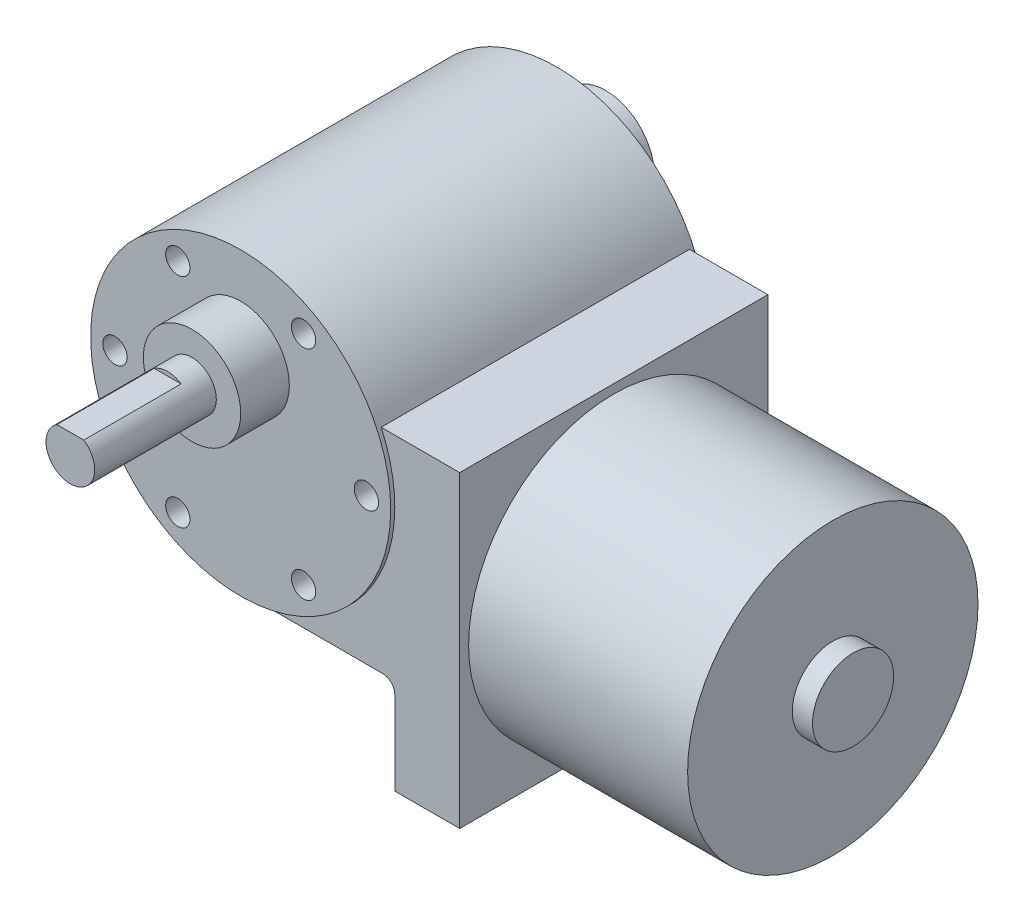
from build123d import *

# Parameters (mm, degrees)
SKETCH_1_R           = 6
EXTRUDE_1_DEPTH      = 6
SKETCH_2_R           = 3
EXTRUDE_2_DEPTH      = 15
SKETCH_4_OUTSIDE_W   = 19.4
SKETCH_4_OUTSIDE_H   = 19.4
CUT_EXTRUDE_1_DEPTH  = 12
SKETCH_5_R           = 18.5
EXTRUDE_3_DEPTH      = 39
EXTRUDE_START        = 6
SKETCH_6_R           = 6
EXTRUDE_4_DEPTH      = 6
SKETCH_7_W           = 38
SKETCH_7_H           = 38
EXTRUDE_5_DEPTH      = 8
EXTRUDE_6_REACH      = 71.176
EXTRUDE_6_END_RADIUS = 18.5
SKETCH_8_W           = 38
SKETCH_8_H           = 26.2
SKETCH_9_R           = 17.9
EXTRUDE_7_DEPTH      = 27
SKETCH_10_R          = 5
EXTRUDE_8_DEPTH      = 2.5
SKETCH_11_R          = 1.5
CUT_EXTRUDE_2_DEPTH  = 4
FILLET_1_R           = 1.5


with BuildPart() as part:
    # ｽｹｯﾁ1 → ﾎﾞｽ - 押し出し1 (new body)
    with BuildSketch(Plane.XY):
        Circle(SKETCH_1_R)
    extrude(amount=EXTRUDE_1_DEPTH)

    # ｽｹｯﾁ2 → ﾎﾞｽ - 押し出し2 (add)
    with BuildSketch(Plane.XY.offset(6)):
        Circle(SKETCH_2_R)
    extrude(amount=EXTRUDE_2_DEPTH)

    # ｽｹｯﾁ4 outside → ｶｯﾄ - 押し出し1 (cut)
    with BuildSketch(Plane.XY.offset(21)):
        Rectangle(SKETCH_4_OUTSIDE_W, SKETCH_4_OUTSIDE_H)
        with BuildLine():
            Line((-1.658312395, 2.5), (1.658312395, 2.5))
            ThreePointArc((1.658312395, 2.5), (0, -3), (-1.658312395, 2.5))
        make_face(mode=Mode.SUBTRACT)
    extrude(amount=-CUT_EXTRUDE_1_DEPTH, mode=Mode.SUBTRACT)

    # ｽｹｯﾁ5 → ﾎﾞｽ - 押し出し3 (add)
    with BuildSketch(Plane.XY):
        with Locations((0, -7)):
            Circle(SKETCH_5_R)
    extrude(amount=-EXTRUDE_3_DEPTH)

    # ｽｹｯﾁ6 → ﾎﾞｽ - 押し出し4 (add)
    with BuildSketch(Plane(origin=(0, 0, -39), x_dir=(-1, 0, 0), z_dir=(0, 0, -1)).offset(EXTRUDE_START)):
        with Locations(Location((0, 0, 0), (0, 0, 180))):
            Circle(SKETCH_6_R)
    extrude(amount=-EXTRUDE_4_DEPTH)



with BuildPart() as body_2:
    # ｽｹｯﾁ7 → ﾎﾞｽ - 押し出し5 (new body)
    with BuildSketch(Plane(origin=(26.5, 0, 0), x_dir=(0, 0, -1), z_dir=(1, 0, 0))):
        with Locations((19.5, -18.3)):
            Rectangle(SKETCH_7_W, SKETCH_7_H)
    extrude(amount=-EXTRUDE_5_DEPTH)


with BuildPart() as part_1:
    add(part.part)

    add(body_2.part)  # ﾎﾞｽ - 押し出し6 merges body 2
    # ﾎﾞｽ - 押し出し6: up to this cylinder (the profile starts outside it)
    extrude_6_end = Plane(origin=(0, -7, -19.5), z_dir=(0, 0, 1)) * Cylinder(EXTRUDE_6_END_RADIUS, 180.352, mode=Mode.PRIVATE)
    # ｽｹｯﾁ8 → ﾎﾞｽ - 押し出し6 (add, up to the surface)
    with BuildSketch(Plane.ZY.offset(-18.5), mode=Mode.PRIVATE) as extrude_6_sk1:
        with Locations((-19.5, -12.4)):
            Rectangle(SKETCH_8_W, SKETCH_8_H)
    extrude_6_tool1 = extrude(extrude_6_sk1.sketch, amount=EXTRUDE_6_REACH, mode=Mode.PRIVATE) - extrude_6_end
    add(extrude_6_tool1.solids().sort_by_distance((18.5, -12.4, -19.5))[0])
    add(extrude_6_tool1.solids().sort_by_distance((18.5, -12.4, -19.5))[1])

    # ｽｹｯﾁ9 → ﾎﾞｽ - 押し出し7 (add)
    with BuildSketch(Plane(origin=(26.5, 0, 0), x_dir=(0, 0, -1), z_dir=(1, 0, 0))):
        with Locations((19.5, -18.3)):
            Circle(SKETCH_9_R)
    extrude(amount=EXTRUDE_7_DEPTH)

    # ｽｹｯﾁ10 → ﾎﾞｽ - 押し出し8 (add)
    with BuildSketch(Plane(origin=(53.5, 0, 0), x_dir=(0, 0, -1), z_dir=(1, 0, 0))):
        with Locations((19.5, -18.3)):
            Circle(SKETCH_10_R)
    extrude(amount=EXTRUDE_8_DEPTH)

    # ｽｹｯﾁ11 → ｶｯﾄ - 押し出し2 (cut)
    with BuildSketch(Plane.XY):
        with Locations((-15.5, -7)):
            Circle(SKETCH_11_R)
        with Locations((-7.75, 6.423393759)):
            Circle(SKETCH_11_R)
        with Locations((7.75, 6.423393759)):
            Circle(SKETCH_11_R)
        with Locations((15.5, -7)):
            Circle(SKETCH_11_R)
        with Locations((7.75, -20.423393759)):
            Circle(SKETCH_11_R)
        with Locations((-7.75, -20.423393759)):
            Circle(SKETCH_11_R)
    extrude(amount=-CUT_EXTRUDE_2_DEPTH, mode=Mode.SUBTRACT)

    # ﾌｨﾚｯﾄ1
    fillet_1_edges = [part_1.edges().sort_by_distance(p)[0] for p in [
        (18.5, -25.5, -19.5),
    ]]
    fillet(fillet_1_edges, radius=FILLET_1_R)


solid = part_1.part
